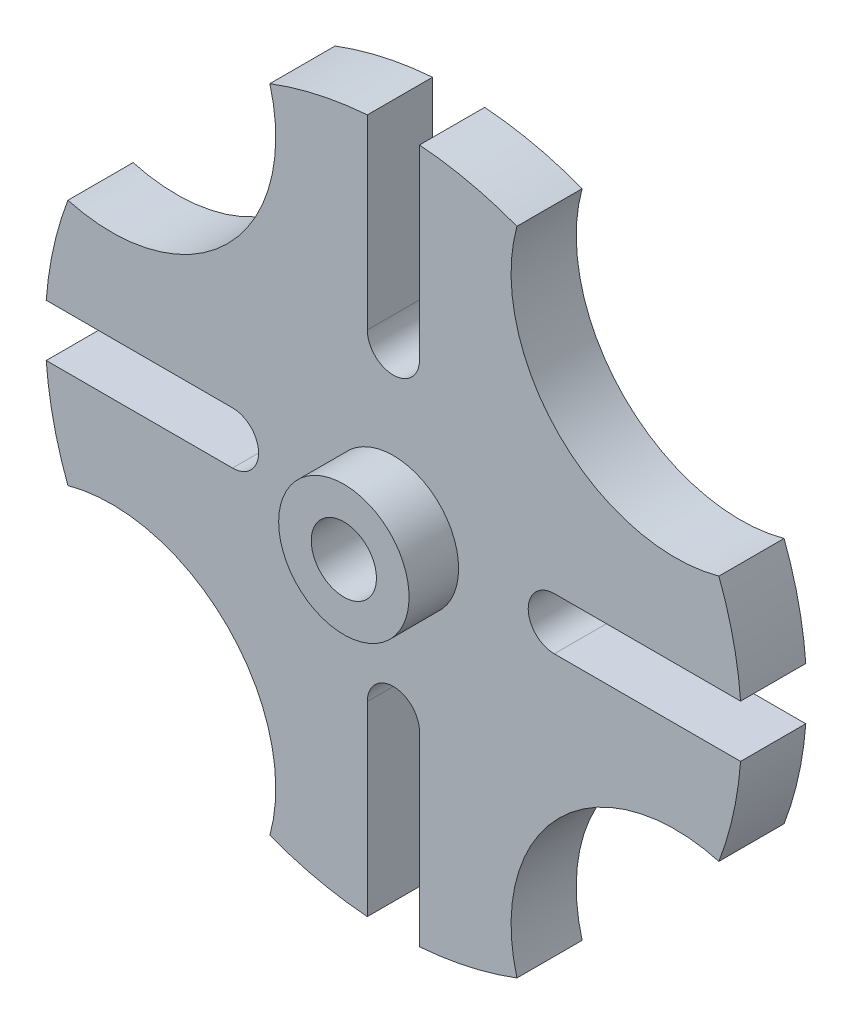
from build123d import *

# Parameters (mm, degrees)
BOSS_EXTRUDE1_DEPTH = 6.35
SKETCH2_R           = 6.35
SKETCH2_R_2         = 3.175
BOSS_EXTRUDE2_DEPTH = 11.176
SKETCH3_R           = 3.175
CUT_EXTRUDE1_DEPTH  = 49.23960885


with BuildPart() as part:
    # Sketch1 → Boss-Extrude1 (new body)
    with BuildSketch(Plane.XY):
        with BuildLine():
            Line((15.670482603, -2.54), (33.813735094, -2.54))
            ThreePointArc((33.813735094, -2.54), (33.100172266, -7.361988656), (31.702602715, -12.03184367))
            ThreePointArc((31.702602715, -12.03184367), (16.146500506, -16.146500506), (12.03184367, -31.702602715))
            ThreePointArc((12.03184367, -31.702602715), (7.361988656, -33.100172266), (2.54, -33.813735094))
            Line((2.54, -33.813735094), (2.54, -15.670482603))
            ThreePointArc((2.54, -15.670482603), (0, -13.130482603), (-2.54, -15.670482603))
            Line((-2.54, -15.670482603), (-2.54, -33.813735094))
            ThreePointArc((-2.54, -33.813735094), (-7.361988656, -33.100172266), (-12.03184367, -31.702602715))
            ThreePointArc((-12.03184367, -31.702602715), (-16.146500506, -16.146500506), (-31.702602715, -12.03184367))
            ThreePointArc((-31.702602715, -12.03184367), (-33.100172266, -7.361988656), (-33.813735094, -2.54))
            Line((-33.813735094, -2.54), (-15.670482603, -2.54))
            ThreePointArc((-15.670482603, -2.54), (-13.130482603, 0), (-15.670482603, 2.54))
            Line((-15.670482603, 2.54), (-33.813735094, 2.54))
            ThreePointArc((-33.813735094, 2.54), (-33.100172266, 7.361988656), (-31.702602715, 12.03184367))
            ThreePointArc((-31.702602715, 12.03184367), (-16.146500506, 16.146500506), (-12.03184367, 31.702602715))
            ThreePointArc((-12.03184367, 31.702602715), (-7.361988656, 33.100172266), (-2.54, 33.813735094))
            Line((-2.54, 33.813735094), (-2.54, 15.670482603))
            ThreePointArc((-2.54, 15.670482603), (0, 13.130482603), (2.54, 15.670482603))
            Line((2.54, 15.670482603), (2.54, 33.813735094))
            ThreePointArc((2.54, 33.813735094), (7.361988656, 33.100172266), (12.03184367, 31.702602715))
            ThreePointArc((12.03184367, 31.702602715), (16.146500506, 16.146500506), (31.702602715, 12.03184367))
            ThreePointArc((31.702602715, 12.03184367), (33.100172266, 7.361988656), (33.813735094, 2.54))
            Line((33.813735094, 2.54), (15.670482603, 2.54))
            ThreePointArc((15.670482603, 2.54), (13.130482603, 0), (15.670482603, -2.54))
        make_face()
    extrude(amount=BOSS_EXTRUDE1_DEPTH)

    # Sketch2 → Boss-Extrude2 (add)
    with BuildSketch(Plane(origin=(0, 0, 0), x_dir=(-1, 0, 0), z_dir=(0, 0, -1))):
        Circle(SKETCH2_R)
        Circle(SKETCH2_R_2, mode=Mode.SUBTRACT)
    extrude(amount=-BOSS_EXTRUDE2_DEPTH)

    # Sketch3 → Cut-Extrude1 (cut, through all)
    with BuildSketch(Plane.XY.offset(6.35)):
        with Locations(Location((0, 0, 0), (0, 0, 180))):
            Circle(SKETCH3_R)
    extrude(amount=-CUT_EXTRUDE1_DEPTH, mode=Mode.SUBTRACT)


solid = part.part
